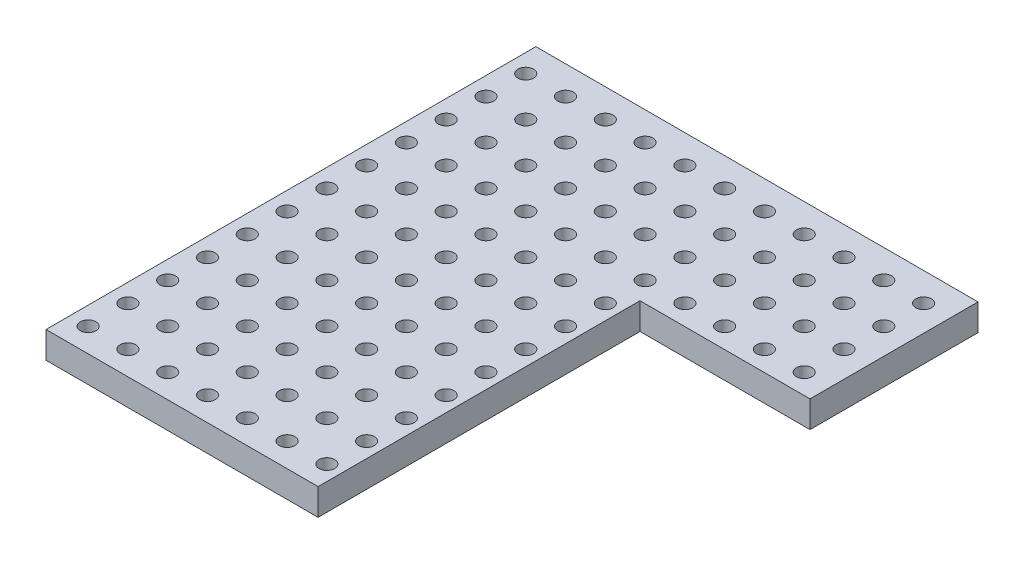
from build123d import *

# Parameters (mm, degrees)
SKETCH1_W           = 60
SKETCH1_H           = 40
SKETCH1_R           = 0.5
BOSS_EXTRUDE1_DEPTH = 1.7018
SKETCH2_W           = 60
SKETCH2_H           = 40
CUT_EXTRUDE2_DEPTH  = 37.095652415


with BuildPart() as part:
    # Sketch1 → Boss-Extrude1 (new body)
    with BuildSketch(Plane(origin=(0, 0, 0), x_dir=(1, 0, 0), z_dir=(0, 1, 0))):
        Rectangle(SKETCH1_W, SKETCH1_H)
        with Locations((24.158, 16.571)):
            Circle(SKETCH1_R, mode=Mode.SUBTRACT)
        with Locations((21.618, 16.571)):
            Circle(SKETCH1_R, mode=Mode.SUBTRACT)
        with Locations((19.078, 16.571)):
            Circle(SKETCH1_R, mode=Mode.SUBTRACT)
        with Locations((16.538, 16.571)):
            Circle(SKETCH1_R, mode=Mode.SUBTRACT)
        with Locations((13.998, 16.571)):
            Circle(SKETCH1_R, mode=Mode.SUBTRACT)
        with Locations((11.458, 16.571)):
            Circle(SKETCH1_R, mode=Mode.SUBTRACT)
        with Locations((8.918, 16.571)):
            Circle(SKETCH1_R, mode=Mode.SUBTRACT)
        with Locations((6.378, 16.571)):
            Circle(SKETCH1_R, mode=Mode.SUBTRACT)
        with Locations((3.838, 16.571)):
            Circle(SKETCH1_R, mode=Mode.SUBTRACT)
        with Locations((1.298, 16.571)):
            Circle(SKETCH1_R, mode=Mode.SUBTRACT)
        with Locations((-1.242, 16.571)):
            Circle(SKETCH1_R, mode=Mode.SUBTRACT)
        with Locations((-3.782, 16.571)):
            Circle(SKETCH1_R, mode=Mode.SUBTRACT)
        with Locations((-6.322, 16.571)):
            Circle(SKETCH1_R, mode=Mode.SUBTRACT)
        with Locations((-8.862, 16.571)):
            Circle(SKETCH1_R, mode=Mode.SUBTRACT)
        with Locations((-11.402, 16.571)):
            Circle(SKETCH1_R, mode=Mode.SUBTRACT)
        with Locations((-13.942, 16.571)):
            Circle(SKETCH1_R, mode=Mode.SUBTRACT)
        with Locations((-16.482, 16.571)):
            Circle(SKETCH1_R, mode=Mode.SUBTRACT)
        with Locations((-19.022, 16.571)):
            Circle(SKETCH1_R, mode=Mode.SUBTRACT)
        with Locations((-21.562, 16.571)):
            Circle(SKETCH1_R, mode=Mode.SUBTRACT)
        with Locations((-24.102, 16.571)):
            Circle(SKETCH1_R, mode=Mode.SUBTRACT)
        with Locations((21.618, 14.031)):
            Circle(SKETCH1_R, mode=Mode.SUBTRACT)
        with Locations((19.078, 14.031)):
            Circle(SKETCH1_R, mode=Mode.SUBTRACT)
        with Locations((16.538, 14.031)):
            Circle(SKETCH1_R, mode=Mode.SUBTRACT)
        with Locations((13.998, 14.031)):
            Circle(SKETCH1_R, mode=Mode.SUBTRACT)
        with Locations((11.458, 14.031)):
            Circle(SKETCH1_R, mode=Mode.SUBTRACT)
        with Locations((8.918, 14.031)):
            Circle(SKETCH1_R, mode=Mode.SUBTRACT)
        with Locations((6.378, 14.031)):
            Circle(SKETCH1_R, mode=Mode.SUBTRACT)
        with Locations((3.838, 14.031)):
            Circle(SKETCH1_R, mode=Mode.SUBTRACT)
        with Locations((1.298, 14.031)):
            Circle(SKETCH1_R, mode=Mode.SUBTRACT)
        with Locations((-1.242, 14.031)):
            Circle(SKETCH1_R, mode=Mode.SUBTRACT)
        with Locations((-3.782, 14.031)):
            Circle(SKETCH1_R, mode=Mode.SUBTRACT)
        with Locations((-6.322, 14.031)):
            Circle(SKETCH1_R, mode=Mode.SUBTRACT)
        with Locations((-8.862, 14.031)):
            Circle(SKETCH1_R, mode=Mode.SUBTRACT)
        with Locations((-11.402, 14.031)):
            Circle(SKETCH1_R, mode=Mode.SUBTRACT)
        with Locations((-13.942, 14.031)):
            Circle(SKETCH1_R, mode=Mode.SUBTRACT)
        with Locations((-16.482, 14.031)):
            Circle(SKETCH1_R, mode=Mode.SUBTRACT)
        with Locations((-19.022, 14.031)):
            Circle(SKETCH1_R, mode=Mode.SUBTRACT)
        with Locations((-21.562, 14.031)):
            Circle(SKETCH1_R, mode=Mode.SUBTRACT)
        with Locations((-24.102, 14.031)):
            Circle(SKETCH1_R, mode=Mode.SUBTRACT)
        with Locations((21.618, 11.491)):
            Circle(SKETCH1_R, mode=Mode.SUBTRACT)
        with Locations((19.078, 11.491)):
            Circle(SKETCH1_R, mode=Mode.SUBTRACT)
        with Locations((16.538, 11.491)):
            Circle(SKETCH1_R, mode=Mode.SUBTRACT)
        with Locations((13.998, 11.491)):
            Circle(SKETCH1_R, mode=Mode.SUBTRACT)
        with Locations((11.458, 11.491)):
            Circle(SKETCH1_R, mode=Mode.SUBTRACT)
        with Locations((8.918, 11.491)):
            Circle(SKETCH1_R, mode=Mode.SUBTRACT)
        with Locations((6.378, 11.491)):
            Circle(SKETCH1_R, mode=Mode.SUBTRACT)
        with Locations((3.838, 11.491)):
            Circle(SKETCH1_R, mode=Mode.SUBTRACT)
        with Locations((1.298, 11.491)):
            Circle(SKETCH1_R, mode=Mode.SUBTRACT)
        with Locations((-1.242, 11.491)):
            Circle(SKETCH1_R, mode=Mode.SUBTRACT)
        with Locations((-3.782, 11.491)):
            Circle(SKETCH1_R, mode=Mode.SUBTRACT)
        with Locations((-6.322, 11.491)):
            Circle(SKETCH1_R, mode=Mode.SUBTRACT)
        with Locations((-8.862, 11.491)):
            Circle(SKETCH1_R, mode=Mode.SUBTRACT)
        with Locations((-11.402, 11.491)):
            Circle(SKETCH1_R, mode=Mode.SUBTRACT)
        with Locations((-13.942, 11.491)):
            Circle(SKETCH1_R, mode=Mode.SUBTRACT)
        with Locations((-16.482, 11.491)):
            Circle(SKETCH1_R, mode=Mode.SUBTRACT)
        with Locations((-19.022, 11.491)):
            Circle(SKETCH1_R, mode=Mode.SUBTRACT)
        with Locations((-21.562, 11.491)):
            Circle(SKETCH1_R, mode=Mode.SUBTRACT)
        with Locations((-24.102, 11.491)):
            Circle(SKETCH1_R, mode=Mode.SUBTRACT)
        with Locations((21.618, 8.951)):
            Circle(SKETCH1_R, mode=Mode.SUBTRACT)
        with Locations((19.078, 8.951)):
            Circle(SKETCH1_R, mode=Mode.SUBTRACT)
        with Locations((16.538, 8.951)):
            Circle(SKETCH1_R, mode=Mode.SUBTRACT)
        with Locations((13.998, 8.951)):
            Circle(SKETCH1_R, mode=Mode.SUBTRACT)
        with Locations((11.458, 8.951)):
            Circle(SKETCH1_R, mode=Mode.SUBTRACT)
        with Locations((8.918, 8.951)):
            Circle(SKETCH1_R, mode=Mode.SUBTRACT)
        with Locations((6.378, 8.951)):
            Circle(SKETCH1_R, mode=Mode.SUBTRACT)
        with Locations((3.838, 8.951)):
            Circle(SKETCH1_R, mode=Mode.SUBTRACT)
        with Locations((1.298, 8.951)):
            Circle(SKETCH1_R, mode=Mode.SUBTRACT)
        with Locations((-1.242, 8.951)):
            Circle(SKETCH1_R, mode=Mode.SUBTRACT)
        with Locations((-3.782, 8.951)):
            Circle(SKETCH1_R, mode=Mode.SUBTRACT)
        with Locations((-6.322, 8.951)):
            Circle(SKETCH1_R, mode=Mode.SUBTRACT)
        with Locations((-8.862, 8.951)):
            Circle(SKETCH1_R, mode=Mode.SUBTRACT)
        with Locations((-11.402, 8.951)):
            Circle(SKETCH1_R, mode=Mode.SUBTRACT)
        with Locations((-13.942, 8.951)):
            Circle(SKETCH1_R, mode=Mode.SUBTRACT)
        with Locations((-16.482, 8.951)):
            Circle(SKETCH1_R, mode=Mode.SUBTRACT)
        with Locations((-19.022, 8.951)):
            Circle(SKETCH1_R, mode=Mode.SUBTRACT)
        with Locations((-21.562, 8.951)):
            Circle(SKETCH1_R, mode=Mode.SUBTRACT)
        with Locations((-24.102, 8.951)):
            Circle(SKETCH1_R, mode=Mode.SUBTRACT)
        with Locations((21.618, 6.411)):
            Circle(SKETCH1_R, mode=Mode.SUBTRACT)
        with Locations((19.078, 6.411)):
            Circle(SKETCH1_R, mode=Mode.SUBTRACT)
        with Locations((16.538, 6.411)):
            Circle(SKETCH1_R, mode=Mode.SUBTRACT)
        with Locations((13.998, 6.411)):
            Circle(SKETCH1_R, mode=Mode.SUBTRACT)
        with Locations((11.458, 6.411)):
            Circle(SKETCH1_R, mode=Mode.SUBTRACT)
        with Locations((8.918, 6.411)):
            Circle(SKETCH1_R, mode=Mode.SUBTRACT)
        with Locations((6.378, 6.411)):
            Circle(SKETCH1_R, mode=Mode.SUBTRACT)
        with Locations((3.838, 6.411)):
            Circle(SKETCH1_R, mode=Mode.SUBTRACT)
        with Locations((1.298, 6.411)):
            Circle(SKETCH1_R, mode=Mode.SUBTRACT)
        with Locations((-1.242, 6.411)):
            Circle(SKETCH1_R, mode=Mode.SUBTRACT)
        with Locations((-3.782, 6.411)):
            Circle(SKETCH1_R, mode=Mode.SUBTRACT)
        with Locations((-6.322, 6.411)):
            Circle(SKETCH1_R, mode=Mode.SUBTRACT)
        with Locations((-8.862, 6.411)):
            Circle(SKETCH1_R, mode=Mode.SUBTRACT)
        with Locations((-11.402, 6.411)):
            Circle(SKETCH1_R, mode=Mode.SUBTRACT)
        with Locations((-13.942, 6.411)):
            Circle(SKETCH1_R, mode=Mode.SUBTRACT)
        with Locations((-16.482, 6.411)):
            Circle(SKETCH1_R, mode=Mode.SUBTRACT)
        with Locations((-19.022, 6.411)):
            Circle(SKETCH1_R, mode=Mode.SUBTRACT)
        with Locations((-21.562, 6.411)):
            Circle(SKETCH1_R, mode=Mode.SUBTRACT)
        with Locations((-24.102, 6.411)):
            Circle(SKETCH1_R, mode=Mode.SUBTRACT)
        with Locations((21.618, 3.871)):
            Circle(SKETCH1_R, mode=Mode.SUBTRACT)
        with Locations((19.078, 3.871)):
            Circle(SKETCH1_R, mode=Mode.SUBTRACT)
        with Locations((16.538, 3.871)):
            Circle(SKETCH1_R, mode=Mode.SUBTRACT)
        with Locations((13.998, 3.871)):
            Circle(SKETCH1_R, mode=Mode.SUBTRACT)
        with Locations((11.458, 3.871)):
            Circle(SKETCH1_R, mode=Mode.SUBTRACT)
        with Locations((8.918, 3.871)):
            Circle(SKETCH1_R, mode=Mode.SUBTRACT)
        with Locations((6.378, 3.871)):
            Circle(SKETCH1_R, mode=Mode.SUBTRACT)
        with Locations((3.838, 3.871)):
            Circle(SKETCH1_R, mode=Mode.SUBTRACT)
        with Locations((1.298, 3.871)):
            Circle(SKETCH1_R, mode=Mode.SUBTRACT)
        with Locations((-1.242, 3.871)):
            Circle(SKETCH1_R, mode=Mode.SUBTRACT)
        with Locations((-3.782, 3.871)):
            Circle(SKETCH1_R, mode=Mode.SUBTRACT)
        with Locations((-6.322, 3.871)):
            Circle(SKETCH1_R, mode=Mode.SUBTRACT)
        with Locations((-8.862, 3.871)):
            Circle(SKETCH1_R, mode=Mode.SUBTRACT)
        with Locations((-11.402, 3.871)):
            Circle(SKETCH1_R, mode=Mode.SUBTRACT)
        with Locations((-13.942, 3.871)):
            Circle(SKETCH1_R, mode=Mode.SUBTRACT)
        with Locations((-16.482, 3.871)):
            Circle(SKETCH1_R, mode=Mode.SUBTRACT)
        with Locations((-19.022, 3.871)):
            Circle(SKETCH1_R, mode=Mode.SUBTRACT)
        with Locations((-21.562, 3.871)):
            Circle(SKETCH1_R, mode=Mode.SUBTRACT)
        with Locations((-24.102, 3.871)):
            Circle(SKETCH1_R, mode=Mode.SUBTRACT)
        with Locations((21.618, 1.331)):
            Circle(SKETCH1_R, mode=Mode.SUBTRACT)
        with Locations((19.078, 1.331)):
            Circle(SKETCH1_R, mode=Mode.SUBTRACT)
        with Locations((16.538, 1.331)):
            Circle(SKETCH1_R, mode=Mode.SUBTRACT)
        with Locations((13.998, 1.331)):
            Circle(SKETCH1_R, mode=Mode.SUBTRACT)
        with Locations((11.458, 1.331)):
            Circle(SKETCH1_R, mode=Mode.SUBTRACT)
        with Locations((8.918, 1.331)):
            Circle(SKETCH1_R, mode=Mode.SUBTRACT)
        with Locations((6.378, 1.331)):
            Circle(SKETCH1_R, mode=Mode.SUBTRACT)
        with Locations((3.838, 1.331)):
            Circle(SKETCH1_R, mode=Mode.SUBTRACT)
        with Locations((1.298, 1.331)):
            Circle(SKETCH1_R, mode=Mode.SUBTRACT)
        with Locations((-1.242, 1.331)):
            Circle(SKETCH1_R, mode=Mode.SUBTRACT)
        with Locations((-3.782, 1.331)):
            Circle(SKETCH1_R, mode=Mode.SUBTRACT)
        with Locations((-6.322, 1.331)):
            Circle(SKETCH1_R, mode=Mode.SUBTRACT)
        with Locations((-8.862, 1.331)):
            Circle(SKETCH1_R, mode=Mode.SUBTRACT)
        with Locations((-11.402, 1.331)):
            Circle(SKETCH1_R, mode=Mode.SUBTRACT)
        with Locations((-13.942, 1.331)):
            Circle(SKETCH1_R, mode=Mode.SUBTRACT)
        with Locations((-16.482, 1.331)):
            Circle(SKETCH1_R, mode=Mode.SUBTRACT)
        with Locations((-19.022, 1.331)):
            Circle(SKETCH1_R, mode=Mode.SUBTRACT)
        with Locations((-21.562, 1.331)):
            Circle(SKETCH1_R, mode=Mode.SUBTRACT)
        with Locations((-24.102, 1.331)):
            Circle(SKETCH1_R, mode=Mode.SUBTRACT)
        with Locations((21.618, -1.209)):
            Circle(SKETCH1_R, mode=Mode.SUBTRACT)
        with Locations((19.078, -1.209)):
            Circle(SKETCH1_R, mode=Mode.SUBTRACT)
        with Locations((16.538, -1.209)):
            Circle(SKETCH1_R, mode=Mode.SUBTRACT)
        with Locations((13.998, -1.209)):
            Circle(SKETCH1_R, mode=Mode.SUBTRACT)
        with Locations((11.458, -1.209)):
            Circle(SKETCH1_R, mode=Mode.SUBTRACT)
        with Locations((8.918, -1.209)):
            Circle(SKETCH1_R, mode=Mode.SUBTRACT)
        with Locations((6.378, -1.209)):
            Circle(SKETCH1_R, mode=Mode.SUBTRACT)
        with Locations((3.838, -1.209)):
            Circle(SKETCH1_R, mode=Mode.SUBTRACT)
        with Locations((1.298, -1.209)):
            Circle(SKETCH1_R, mode=Mode.SUBTRACT)
        with Locations((-1.242, -1.209)):
            Circle(SKETCH1_R, mode=Mode.SUBTRACT)
        with Locations((-3.782, -1.209)):
            Circle(SKETCH1_R, mode=Mode.SUBTRACT)
        with Locations((-6.322, -1.209)):
            Circle(SKETCH1_R, mode=Mode.SUBTRACT)
        with Locations((-8.862, -1.209)):
            Circle(SKETCH1_R, mode=Mode.SUBTRACT)
        with Locations((-11.402, -1.209)):
            Circle(SKETCH1_R, mode=Mode.SUBTRACT)
        with Locations((-13.942, -1.209)):
            Circle(SKETCH1_R, mode=Mode.SUBTRACT)
        with Locations((-16.482, -1.209)):
            Circle(SKETCH1_R, mode=Mode.SUBTRACT)
        with Locations((-19.022, -1.209)):
            Circle(SKETCH1_R, mode=Mode.SUBTRACT)
        with Locations((-21.562, -1.209)):
            Circle(SKETCH1_R, mode=Mode.SUBTRACT)
        with Locations((-24.102, -1.209)):
            Circle(SKETCH1_R, mode=Mode.SUBTRACT)
        with Locations((21.618, -3.749)):
            Circle(SKETCH1_R, mode=Mode.SUBTRACT)
        with Locations((19.078, -3.749)):
            Circle(SKETCH1_R, mode=Mode.SUBTRACT)
        with Locations((16.538, -3.749)):
            Circle(SKETCH1_R, mode=Mode.SUBTRACT)
        with Locations((13.998, -3.749)):
            Circle(SKETCH1_R, mode=Mode.SUBTRACT)
        with Locations((11.458, -3.749)):
            Circle(SKETCH1_R, mode=Mode.SUBTRACT)
        with Locations((8.918, -3.749)):
            Circle(SKETCH1_R, mode=Mode.SUBTRACT)
        with Locations((6.378, -3.749)):
            Circle(SKETCH1_R, mode=Mode.SUBTRACT)
        with Locations((3.838, -3.749)):
            Circle(SKETCH1_R, mode=Mode.SUBTRACT)
        with Locations((1.298, -3.749)):
            Circle(SKETCH1_R, mode=Mode.SUBTRACT)
        with Locations((-1.242, -3.749)):
            Circle(SKETCH1_R, mode=Mode.SUBTRACT)
        with Locations((-3.782, -3.749)):
            Circle(SKETCH1_R, mode=Mode.SUBTRACT)
        with Locations((-6.322, -3.749)):
            Circle(SKETCH1_R, mode=Mode.SUBTRACT)
        with Locations((-8.862, -3.749)):
            Circle(SKETCH1_R, mode=Mode.SUBTRACT)
        with Locations((-11.402, -3.749)):
            Circle(SKETCH1_R, mode=Mode.SUBTRACT)
        with Locations((-13.942, -3.749)):
            Circle(SKETCH1_R, mode=Mode.SUBTRACT)
        with Locations((-16.482, -3.749)):
            Circle(SKETCH1_R, mode=Mode.SUBTRACT)
        with Locations((-19.022, -3.749)):
            Circle(SKETCH1_R, mode=Mode.SUBTRACT)
        with Locations((-21.562, -3.749)):
            Circle(SKETCH1_R, mode=Mode.SUBTRACT)
        with Locations((-24.102, -3.749)):
            Circle(SKETCH1_R, mode=Mode.SUBTRACT)
        with Locations((21.618, -6.289)):
            Circle(SKETCH1_R, mode=Mode.SUBTRACT)
        with Locations((19.078, -6.289)):
            Circle(SKETCH1_R, mode=Mode.SUBTRACT)
        with Locations((16.538, -6.289)):
            Circle(SKETCH1_R, mode=Mode.SUBTRACT)
        with Locations((13.998, -6.289)):
            Circle(SKETCH1_R, mode=Mode.SUBTRACT)
        with Locations((11.458, -6.289)):
            Circle(SKETCH1_R, mode=Mode.SUBTRACT)
        with Locations((8.918, -6.289)):
            Circle(SKETCH1_R, mode=Mode.SUBTRACT)
        with Locations((6.378, -6.289)):
            Circle(SKETCH1_R, mode=Mode.SUBTRACT)
        with Locations((3.838, -6.289)):
            Circle(SKETCH1_R, mode=Mode.SUBTRACT)
        with Locations((1.298, -6.289)):
            Circle(SKETCH1_R, mode=Mode.SUBTRACT)
        with Locations((-1.242, -6.289)):
            Circle(SKETCH1_R, mode=Mode.SUBTRACT)
        with Locations((-3.782, -6.289)):
            Circle(SKETCH1_R, mode=Mode.SUBTRACT)
        with Locations((-6.322, -6.289)):
            Circle(SKETCH1_R, mode=Mode.SUBTRACT)
        with Locations((-8.862, -6.289)):
            Circle(SKETCH1_R, mode=Mode.SUBTRACT)
        with Locations((-11.402, -6.289)):
            Circle(SKETCH1_R, mode=Mode.SUBTRACT)
        with Locations((-13.942, -6.289)):
            Circle(SKETCH1_R, mode=Mode.SUBTRACT)
        with Locations((-16.482, -6.289)):
            Circle(SKETCH1_R, mode=Mode.SUBTRACT)
        with Locations((-19.022, -6.289)):
            Circle(SKETCH1_R, mode=Mode.SUBTRACT)
        with Locations((-21.562, -6.289)):
            Circle(SKETCH1_R, mode=Mode.SUBTRACT)
        with Locations((-24.102, -6.289)):
            Circle(SKETCH1_R, mode=Mode.SUBTRACT)
        with Locations((21.618, -8.829)):
            Circle(SKETCH1_R, mode=Mode.SUBTRACT)
        with Locations((19.078, -8.829)):
            Circle(SKETCH1_R, mode=Mode.SUBTRACT)
        with Locations((16.538, -8.829)):
            Circle(SKETCH1_R, mode=Mode.SUBTRACT)
        with Locations((13.998, -8.829)):
            Circle(SKETCH1_R, mode=Mode.SUBTRACT)
        with Locations((11.458, -8.829)):
            Circle(SKETCH1_R, mode=Mode.SUBTRACT)
        with Locations((8.918, -8.829)):
            Circle(SKETCH1_R, mode=Mode.SUBTRACT)
        with Locations((6.378, -8.829)):
            Circle(SKETCH1_R, mode=Mode.SUBTRACT)
        with Locations((3.838, -8.829)):
            Circle(SKETCH1_R, mode=Mode.SUBTRACT)
        with Locations((1.298, -8.829)):
            Circle(SKETCH1_R, mode=Mode.SUBTRACT)
        with Locations((-1.242, -8.829)):
            Circle(SKETCH1_R, mode=Mode.SUBTRACT)
        with Locations((-3.782, -8.829)):
            Circle(SKETCH1_R, mode=Mode.SUBTRACT)
        with Locations((-6.322, -8.829)):
            Circle(SKETCH1_R, mode=Mode.SUBTRACT)
        with Locations((-8.862, -8.829)):
            Circle(SKETCH1_R, mode=Mode.SUBTRACT)
        with Locations((-11.402, -8.829)):
            Circle(SKETCH1_R, mode=Mode.SUBTRACT)
        with Locations((-13.942, -8.829)):
            Circle(SKETCH1_R, mode=Mode.SUBTRACT)
        with Locations((-16.482, -8.829)):
            Circle(SKETCH1_R, mode=Mode.SUBTRACT)
        with Locations((-19.022, -8.829)):
            Circle(SKETCH1_R, mode=Mode.SUBTRACT)
        with Locations((-21.562, -8.829)):
            Circle(SKETCH1_R, mode=Mode.SUBTRACT)
        with Locations((-24.102, -8.829)):
            Circle(SKETCH1_R, mode=Mode.SUBTRACT)
        with Locations((21.618, -11.369)):
            Circle(SKETCH1_R, mode=Mode.SUBTRACT)
        with Locations((19.078, -11.369)):
            Circle(SKETCH1_R, mode=Mode.SUBTRACT)
        with Locations((16.538, -11.369)):
            Circle(SKETCH1_R, mode=Mode.SUBTRACT)
        with Locations((13.998, -11.369)):
            Circle(SKETCH1_R, mode=Mode.SUBTRACT)
        with Locations((11.458, -11.369)):
            Circle(SKETCH1_R, mode=Mode.SUBTRACT)
        with Locations((8.918, -11.369)):
            Circle(SKETCH1_R, mode=Mode.SUBTRACT)
        with Locations((6.378, -11.369)):
            Circle(SKETCH1_R, mode=Mode.SUBTRACT)
        with Locations((3.838, -11.369)):
            Circle(SKETCH1_R, mode=Mode.SUBTRACT)
        with Locations((1.298, -11.369)):
            Circle(SKETCH1_R, mode=Mode.SUBTRACT)
        with Locations((-1.242, -11.369)):
            Circle(SKETCH1_R, mode=Mode.SUBTRACT)
        with Locations((-3.782, -11.369)):
            Circle(SKETCH1_R, mode=Mode.SUBTRACT)
        with Locations((-6.322, -11.369)):
            Circle(SKETCH1_R, mode=Mode.SUBTRACT)
        with Locations((-8.862, -11.369)):
            Circle(SKETCH1_R, mode=Mode.SUBTRACT)
        with Locations((-11.402, -11.369)):
            Circle(SKETCH1_R, mode=Mode.SUBTRACT)
        with Locations((-13.942, -11.369)):
            Circle(SKETCH1_R, mode=Mode.SUBTRACT)
        with Locations((-16.482, -11.369)):
            Circle(SKETCH1_R, mode=Mode.SUBTRACT)
        with Locations((-19.022, -11.369)):
            Circle(SKETCH1_R, mode=Mode.SUBTRACT)
        with Locations((-21.562, -11.369)):
            Circle(SKETCH1_R, mode=Mode.SUBTRACT)
        with Locations((-24.102, -11.369)):
            Circle(SKETCH1_R, mode=Mode.SUBTRACT)
        with Locations((21.618, -13.909)):
            Circle(SKETCH1_R, mode=Mode.SUBTRACT)
        with Locations((19.078, -13.909)):
            Circle(SKETCH1_R, mode=Mode.SUBTRACT)
        with Locations((16.538, -13.909)):
            Circle(SKETCH1_R, mode=Mode.SUBTRACT)
        with Locations((13.998, -13.909)):
            Circle(SKETCH1_R, mode=Mode.SUBTRACT)
        with Locations((11.458, -13.909)):
            Circle(SKETCH1_R, mode=Mode.SUBTRACT)
        with Locations((8.918, -13.909)):
            Circle(SKETCH1_R, mode=Mode.SUBTRACT)
        with Locations((6.378, -13.909)):
            Circle(SKETCH1_R, mode=Mode.SUBTRACT)
        with Locations((3.838, -13.909)):
            Circle(SKETCH1_R, mode=Mode.SUBTRACT)
        with Locations((1.298, -13.909)):
            Circle(SKETCH1_R, mode=Mode.SUBTRACT)
        with Locations((-1.242, -13.909)):
            Circle(SKETCH1_R, mode=Mode.SUBTRACT)
        with Locations((-3.782, -13.909)):
            Circle(SKETCH1_R, mode=Mode.SUBTRACT)
        with Locations((-6.322, -13.909)):
            Circle(SKETCH1_R, mode=Mode.SUBTRACT)
        with Locations((-8.862, -13.909)):
            Circle(SKETCH1_R, mode=Mode.SUBTRACT)
        with Locations((-11.402, -13.909)):
            Circle(SKETCH1_R, mode=Mode.SUBTRACT)
        with Locations((-13.942, -13.909)):
            Circle(SKETCH1_R, mode=Mode.SUBTRACT)
        with Locations((-16.482, -13.909)):
            Circle(SKETCH1_R, mode=Mode.SUBTRACT)
        with Locations((-19.022, -13.909)):
            Circle(SKETCH1_R, mode=Mode.SUBTRACT)
        with Locations((-21.562, -13.909)):
            Circle(SKETCH1_R, mode=Mode.SUBTRACT)
        with Locations((-24.102, -13.909)):
            Circle(SKETCH1_R, mode=Mode.SUBTRACT)
        with Locations((21.618, -16.449)):
            Circle(SKETCH1_R, mode=Mode.SUBTRACT)
        with Locations((19.078, -16.449)):
            Circle(SKETCH1_R, mode=Mode.SUBTRACT)
        with Locations((16.538, -16.449)):
            Circle(SKETCH1_R, mode=Mode.SUBTRACT)
        with Locations((13.998, -16.449)):
            Circle(SKETCH1_R, mode=Mode.SUBTRACT)
        with Locations((11.458, -16.449)):
            Circle(SKETCH1_R, mode=Mode.SUBTRACT)
        with Locations((8.918, -16.449)):
            Circle(SKETCH1_R, mode=Mode.SUBTRACT)
        with Locations((6.378, -16.449)):
            Circle(SKETCH1_R, mode=Mode.SUBTRACT)
        with Locations((3.838, -16.449)):
            Circle(SKETCH1_R, mode=Mode.SUBTRACT)
        with Locations((1.298, -16.449)):
            Circle(SKETCH1_R, mode=Mode.SUBTRACT)
        with Locations((-1.242, -16.449)):
            Circle(SKETCH1_R, mode=Mode.SUBTRACT)
        with Locations((-3.782, -16.449)):
            Circle(SKETCH1_R, mode=Mode.SUBTRACT)
        with Locations((-6.322, -16.449)):
            Circle(SKETCH1_R, mode=Mode.SUBTRACT)
        with Locations((-8.862, -16.449)):
            Circle(SKETCH1_R, mode=Mode.SUBTRACT)
        with Locations((-11.402, -16.449)):
            Circle(SKETCH1_R, mode=Mode.SUBTRACT)
        with Locations((-13.942, -16.449)):
            Circle(SKETCH1_R, mode=Mode.SUBTRACT)
        with Locations((-16.482, -16.449)):
            Circle(SKETCH1_R, mode=Mode.SUBTRACT)
        with Locations((-19.022, -16.449)):
            Circle(SKETCH1_R, mode=Mode.SUBTRACT)
        with Locations((-21.562, -16.449)):
            Circle(SKETCH1_R, mode=Mode.SUBTRACT)
        with Locations((-24.102, -16.449)):
            Circle(SKETCH1_R, mode=Mode.SUBTRACT)
        with Locations((24.158, 14.031)):
            Circle(SKETCH1_R, mode=Mode.SUBTRACT)
        with Locations((24.158, 11.491)):
            Circle(SKETCH1_R, mode=Mode.SUBTRACT)
        with Locations((24.158, 8.951)):
            Circle(SKETCH1_R, mode=Mode.SUBTRACT)
        with Locations((24.158, 6.411)):
            Circle(SKETCH1_R, mode=Mode.SUBTRACT)
        with Locations((24.158, 3.871)):
            Circle(SKETCH1_R, mode=Mode.SUBTRACT)
        with Locations((24.158, 1.331)):
            Circle(SKETCH1_R, mode=Mode.SUBTRACT)
        with Locations((24.158, -1.209)):
            Circle(SKETCH1_R, mode=Mode.SUBTRACT)
        with Locations((24.158, -3.749)):
            Circle(SKETCH1_R, mode=Mode.SUBTRACT)
        with Locations((24.158, -6.289)):
            Circle(SKETCH1_R, mode=Mode.SUBTRACT)
        with Locations((24.158, -8.829)):
            Circle(SKETCH1_R, mode=Mode.SUBTRACT)
        with Locations((24.158, -11.369)):
            Circle(SKETCH1_R, mode=Mode.SUBTRACT)
        with Locations((24.158, -13.909)):
            Circle(SKETCH1_R, mode=Mode.SUBTRACT)
        with Locations((24.158, -16.449)):
            Circle(SKETCH1_R, mode=Mode.SUBTRACT)
    extrude(amount=BOSS_EXTRUDE1_DEPTH)

    # Sketch2 → Cut-Extrude2 (cut, through all)
    with BuildSketch(Plane(origin=(0, 1.7018, 0), x_dir=(1, 0, 0), z_dir=(0, 1, 0))):
        Rectangle(SKETCH2_W, SKETCH2_H)
        Polygon((-2.409005858, -12.892672005), (-2.409005858, 18.386789592), (25.818069822, 18.386789592), (25.818069822, 7.660669065), (14.963965435, 7.660669065), (14.963965435, -12.892672005), align=None, mode=Mode.SUBTRACT)
    extrude(amount=-CUT_EXTRUDE2_DEPTH, mode=Mode.SUBTRACT)


solid = part.part
